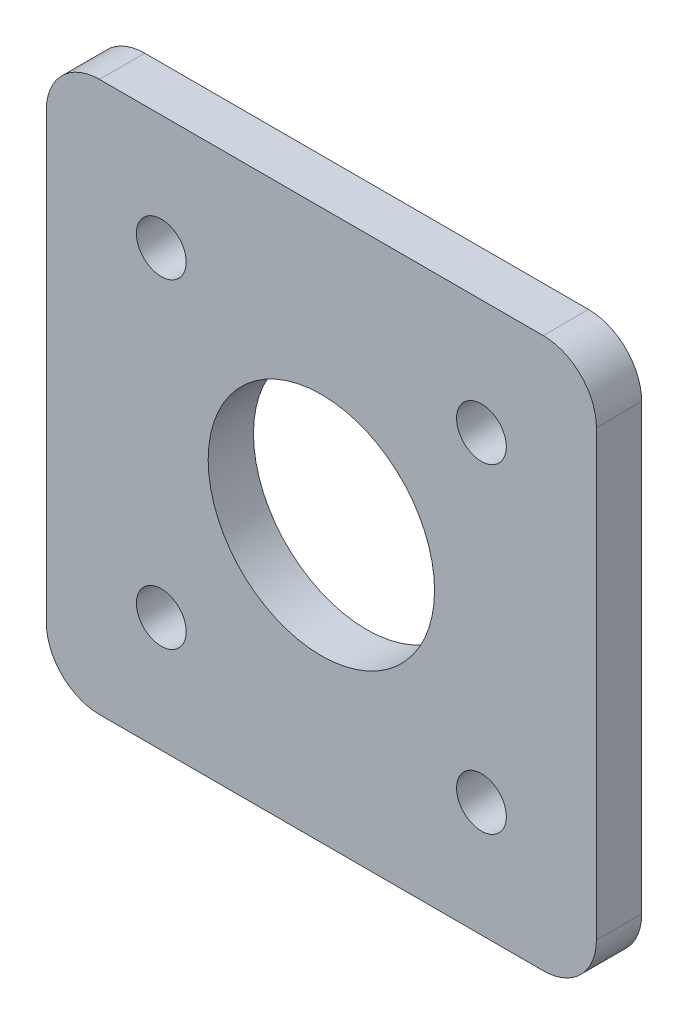
from build123d import *

# Parameters (mm, degrees)
CROQUIS1_R              = 1.1
CROQUIS1_R_2            = 3
SALIENTE_EXTRUIR1_DEPTH = 2
CORTAR_EXTRUIR1_START   = -2
CORTAR_EXTRUIR1_DEPTH   = 2
CROQUIS3_R              = 5
CORTAR_EXTRUIR2_DEPTH   = 2


with BuildPart() as part:
    # Croquis1 → Saliente-Extruir1 (new body)
    with BuildSketch(Plane.XY):
        with BuildLine():
            Line((-64.740473431, 32.731866916), (-64.740473431, 13.131866916))
            ThreePointArc((-64.740473431, 13.131866916), (-63.949661741, 11.222678607), (-62.040473431, 10.431866916))
            Line((-62.040473431, 10.431866916), (-42.440473431, 10.431866916))
            ThreePointArc((-42.440473431, 10.431866916), (-40.531285122, 11.222678607), (-39.740473431, 13.131866916))
            Line((-39.740473431, 13.131866916), (-39.740473431, 32.731866916))
            ThreePointArc((-39.740473431, 32.731866916), (-40.531285122, 34.641055225), (-42.440473431, 35.431866916))
            Line((-42.440473431, 35.431866916), (-62.040473431, 35.431866916))
            ThreePointArc((-62.040473431, 35.431866916), (-63.949661741, 34.641055225), (-64.740473431, 32.731866916))
        make_face()
        with Locations((-45.16940562, 30.002934728)):
            Circle(CROQUIS1_R, mode=Mode.SUBTRACT)
        with Locations((-52.240473431, 22.931866916)):
            Circle(CROQUIS1_R_2, mode=Mode.SUBTRACT)
        with Locations((-45.16940562, 15.860799104)):
            Circle(CROQUIS1_R, mode=Mode.SUBTRACT)
        with Locations((-59.311541243, 15.860799104)):
            Circle(CROQUIS1_R, mode=Mode.SUBTRACT)
        with Locations((-59.311541243, 30.002934728)):
            Circle(CROQUIS1_R, mode=Mode.SUBTRACT)
    extrude(amount=SALIENTE_EXTRUIR1_DEPTH)

    # Croquis2 → Cortar-Extruir1 (cut)
    with BuildSketch(Plane.XY.offset(2).offset(CORTAR_EXTRUIR1_START)):
        with BuildLine():
            Line((-64.740473431, 32.731866916), (-64.740473431, 13.131866916))
            ThreePointArc((-64.740473431, 13.131866916), (-63.949661741, 11.222678607), (-62.040473431, 10.431866916))
            Line((-62.040473431, 10.431866916), (-42.440473431, 10.431866916))
            ThreePointArc((-42.440473431, 10.431866916), (-40.531285122, 11.222678607), (-39.740473431, 13.131866916))
            Line((-39.740473431, 13.131866916), (-39.740473431, 32.731866916))
            ThreePointArc((-39.740473431, 32.731866916), (-40.531285122, 34.641055225), (-42.440473431, 35.431866916))
            Line((-42.440473431, 35.431866916), (-62.040473431, 35.431866916))
            ThreePointArc((-62.040473431, 35.431866916), (-63.949661741, 34.641055225), (-64.740473431, 32.731866916))
        make_face()
        with BuildLine():
            Line((-64.390473431, 32.731866916), (-64.390473431, 13.131866916))
            ThreePointArc((-64.390473431, 13.131866916), (-63.702174367, 11.47016598), (-62.040473431, 10.781866916))
            Line((-62.040473431, 10.781866916), (-42.440473431, 10.781866916))
            ThreePointArc((-42.440473431, 10.781866916), (-40.778772496, 11.47016598), (-40.090473431, 13.131866916))
            Line((-40.090473431, 13.131866916), (-40.090473431, 32.731866916))
            ThreePointArc((-40.090473431, 32.731866916), (-40.778772496, 34.393567852), (-42.440473431, 35.081866916))
            Line((-42.440473431, 35.081866916), (-62.040473431, 35.081866916))
            ThreePointArc((-62.040473431, 35.081866916), (-63.702174367, 34.393567852), (-64.390473431, 32.731866916))
        make_face(mode=Mode.SUBTRACT)
    extrude(amount=CORTAR_EXTRUIR1_DEPTH, mode=Mode.SUBTRACT)

    # Croquis3 → Cortar-Extruir2 (cut)
    with BuildSketch(Plane.XY.offset(2)):
        with Locations((-52.240473431, 22.931866916)):
            Circle(CROQUIS3_R)
    extrude(amount=-CORTAR_EXTRUIR2_DEPTH, mode=Mode.SUBTRACT)


solid = part.part
